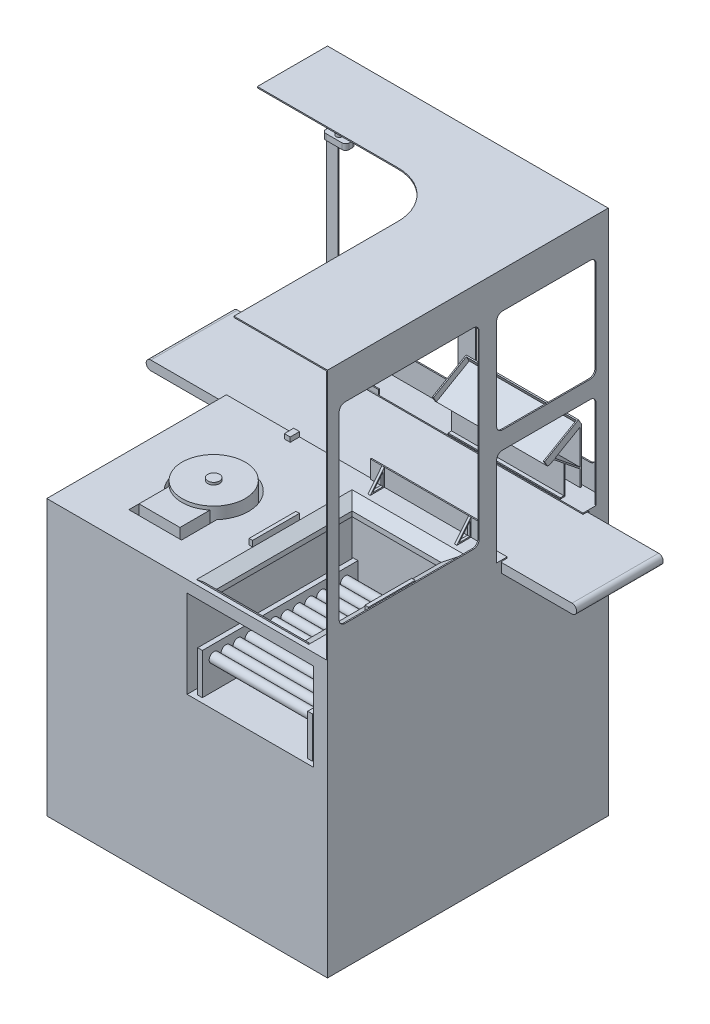
from build123d import *
from build123d.topology import SkipClean

# Parameters (mm, degrees)
SKETCH1_W              = 1200
SKETCH1_H              = 1200
SKETCH1_W_2            = 1190
SKETCH1_H_2            = 1190
BOSS_EXTRUDE1_DEPTH    = 1125
SKETCH2_W              = 540
SKETCH2_H              = 375
CUT_EXTRUDE1_DEPTH     = 50
BOSS_EXTRUDE2_START    = 80
BOSS_EXTRUDE2_DEPTH    = 370
SKETCH4_W              = 1200
SKETCH4_H              = 743
SKETCH4_H_2            = 83
BOSS_EXTRUDE3_DEPTH    = 50
SKETCH5_W              = 380
SKETCH5_H              = 600
CUT_EXTRUDE2_DEPTH     = 50
BOSS_EXTRUDE4_DEPTH    = 375
SKETCH7_W              = 550
SKETCH7_H              = 705
BOSS_EXTRUDE5_DEPTH    = 5
CHAMFER1_SIZE          = 50
CHAMFER1_SIZE2         = 28.867513459
CHAMFER2_SIZE          = 15
CHAMFER2_SIZE2         = 8.660254038
SKETCH8_W              = 1200
SKETCH8_H              = 5
BOSS_EXTRUDE6_DEPTH    = 25
SKETCH9_W              = 1200
SKETCH9_H              = 5
BOSS_EXTRUDE7_DEPTH    = 25
SKETCH10_W             = 20
SKETCH10_H             = 665
BOSS_EXTRUDE8_DEPTH    = 175
SKETCH11_R             = 20.831624677
BOSS_EXTRUDE9_DEPTH    = 450
SKETCH12_W             = 1200
SKETCH12_H             = 5
BOSS_EXTRUDE10_DEPTH   = 1070
CUT_EXTRUDE3_DEPTH     = 50
SKETCH14_W             = 5
SKETCH14_H             = 1195
BOSS_EXTRUDE11_DEPTH   = 1070
CUT_EXTRUDE4_DEPTH     = 50
BOSS_EXTRUDE14_DEPTH   = 5
SKETCH26_W             = 50
SKETCH26_H             = 5
BOSS_EXTRUDE15_DEPTH   = 20
SKETCH26_W_2           = 25
SKETCH26_H_2           = 40
BOSS_EXTRUDE15_2_DEPTH = 20
SKETCH28_R             = 12.5
BOSS_EXTRUDE16_DEPTH   = 50
BOSS_EXTRUDE17_DEPTH   = 25
SKETCH30_R             = 12.5
BOSS_EXTRUDE18_DEPTH   = 50
BOSS_EXTRUDE19_DEPTH   = 25
SKETCH33_W             = 15
SKETCH33_H             = 200
BOSS_EXTRUDE20_DEPTH   = 25
BOSS_EXTRUDE20_2_DEPTH = 25
CUT_EXTRUDE6_DEPTH     = 50
BOSS_EXTRUDE21_DEPTH   = 50
BOSS_EXTRUDE22_DEPTH   = 5
SKETCH37_R             = 135
BOSS_EXTRUDE23_DEPTH   = 140
BOSS_EXTRUDE24_DEPTH   = 125
SKETCH39_R             = 25
BOSS_EXTRUDE25_DEPTH   = 10
SKETCH40_W             = 480
SKETCH40_H             = 5
BOSS_EXTRUDE26_DEPTH   = 75
BOSS_EXTRUDE27_START   = -50
BOSS_EXTRUDE27_DEPTH   = 10
BOSS_EXTRUDE28_START   = -50
BOSS_EXTRUDE28_DEPTH   = 10
SKETCH44_W             = 480
SKETCH44_H             = 5
BOSS_EXTRUDE30_DEPTH   = 300
SKETCH45_W             = 480
SKETCH45_H             = 150
BOSS_EXTRUDE31_DEPTH   = 225
CUT_EXTRUDE7_DEPTH     = 550
BOSS_EXTRUDE32_REACH   = 1610.423
SKETCH47_W             = 480
SKETCH47_H             = 139.903810568
CUT_EXTRUDE8_DEPTH     = 550
BOSS_EXTRUDE33_DEPTH   = 25
SKETCH50_W             = 480
SKETCH50_H             = 5
BOSS_EXTRUDE34_DEPTH   = 15


with BuildPart() as part:
    # Sketch1 → Boss-Extrude1 (new body)
    with BuildSketch(Plane(origin=(0, 0, 0), x_dir=(1, 0, 0), z_dir=(0, 1, 0))):
        Rectangle(SKETCH1_W, SKETCH1_H)
        Rectangle(SKETCH1_W_2, SKETCH1_H_2, mode=Mode.SUBTRACT)
    extrude(amount=BOSS_EXTRUDE1_DEPTH)

    # Sketch2 → Cut-Extrude1 (cut)
    with BuildSketch(Plane.XY.offset(600)):
        with Locations((270, 937.5)):
            Rectangle(SKETCH2_W, SKETCH2_H)
    extrude(amount=-CUT_EXTRUDE1_DEPTH, mode=Mode.SUBTRACT)

    # Sketch4 → Boss-Extrude3 (add)
    with BuildSketch(Plane(origin=(0, 1125, 0), x_dir=(1, 0, 0), z_dir=(0, 1, 0))):
        with Locations((0, -228.5)):
            Rectangle(SKETCH4_W, SKETCH4_H)
        with Locations((0, 558.5)):
            Rectangle(SKETCH4_W, SKETCH4_H_2)
    extrude(amount=BOSS_EXTRUDE3_DEPTH)

    # Sketch5 → Cut-Extrude2 (cut)
    with BuildSketch(Plane(origin=(0, 1175, 0), x_dir=(1, 0, 0), z_dir=(0, 1, 0))):
        with Locations((260, -265)):
            Rectangle(SKETCH5_W, SKETCH5_H)
    extrude(amount=-CUT_EXTRUDE2_DEPTH, mode=Mode.SUBTRACT)

    # Sketch6 → Boss-Extrude4 (add)
    with BuildSketch(Plane.XZ.offset(-1125)):
        Polygon((0, 595), (0, -105), (540, -105), (540, 595), (545, 595), (545, -110), (-5, -110), (-5, 595), align=None)
    extrude(amount=BOSS_EXTRUDE4_DEPTH)

    # Sketch7 → Boss-Extrude5 (add)
    with BuildSketch(Plane.XZ.offset(-750)):
        with Locations((270, 242.5)):
            Rectangle(SKETCH7_W, SKETCH7_H)
    extrude(amount=BOSS_EXTRUDE5_DEPTH)

    # Chamfer1
    chamfer1_edges = [part.edges().sort_by_distance(p)[0] for p in [
        (70, 1175, 265),
        (450, 1175, 265),
        (260, 1175, -35),
    ]]
    chamfer1_side = [part.faces().sort_by_distance(p)[0] for p in [
        (-89.330922242, 1175, 215.959312839),
    ]]
    chamfer(chamfer1_edges, length=CHAMFER1_SIZE, length2=CHAMFER1_SIZE2, reference=chamfer1_side[0])

    # Chamfer2
    chamfer2_edges = [part.edges().sort_by_distance(p)[0] for p in [
        (260, 1175, 565),
    ]]
    chamfer2_side = [part.faces().sort_by_distance(p)[0] for p in [
        (-139.958592133, 1175, 222.30952381),
    ]]
    chamfer(chamfer2_edges, length=CHAMFER2_SIZE, length2=CHAMFER2_SIZE2, reference=chamfer2_side[0])

    # Sketch8 → Boss-Extrude6 (add)
    with BuildSketch(Plane.XY.offset(-517)):
        with Locations((0, 1172.5)):
            Rectangle(SKETCH8_W, SKETCH8_H)
    extrude(amount=BOSS_EXTRUDE6_DEPTH)

    # Sketch9 → Boss-Extrude7 (add)
    with BuildSketch(Plane(origin=(0, 0, -143), x_dir=(-1, 0, 0), z_dir=(0, 0, -1))):
        with Locations((0, 1172.5)):
            Rectangle(SKETCH9_W, SKETCH9_H)
    extrude(amount=BOSS_EXTRUDE7_DEPTH)

    # Sketch10 → Boss-Extrude8 (add)
    with BuildSketch(Plane(origin=(0, 750, 0), x_dir=(1, 0, 0), z_dir=(0, 1, 0))):
        with Locations((35, -247.5)):
            Rectangle(SKETCH10_W, SKETCH10_H)
        with Locations((505, -247.5)):
            Rectangle(SKETCH10_W, SKETCH10_H)
    extrude(amount=BOSS_EXTRUDE8_DEPTH)

    # Sketch11 → Boss-Extrude9 (add)
    with BuildSketch(Plane(origin=(45, 0, 0), x_dir=(0, 0, -1), z_dir=(1, 0, 0))):
        with Locations(Location((-530, 875, 0), (0, 0, 270))):
            Circle(SKETCH11_R)
        with Locations(Location((-479, 875, 0), (0, 0, 270))):
            Circle(SKETCH11_R)
        with Locations(Location((-428, 875, 0), (0, 0, 270))):
            Circle(SKETCH11_R)
        with Locations(Location((-377, 875, 0), (0, 0, 270))):
            Circle(SKETCH11_R)
        with Locations(Location((-326, 875, 0), (0, 0, 270))):
            Circle(SKETCH11_R)
        with Locations(Location((-275, 875, 0), (0, 0, 270))):
            Circle(SKETCH11_R)
        with Locations(Location((-224, 875, 0), (0, 0, 270))):
            Circle(SKETCH11_R)
        with Locations(Location((-173, 875, 0), (0, 0, 270))):
            Circle(SKETCH11_R)
        with Locations(Location((-122, 875, 0), (0, 0, 270))):
            Circle(SKETCH11_R)
        with Locations(Location((-71, 875, 0), (0, 0, 270))):
            Circle(SKETCH11_R)
        with Locations(Location((-20, 875, 0), (0, 0, 270))):
            Circle(SKETCH11_R)
        with Locations(Location((31, 875, 0), (0, 0, 270))):
            Circle(SKETCH11_R)
    extrude(amount=BOSS_EXTRUDE9_DEPTH)

    # Sketch12 → Boss-Extrude10 (add)
    with BuildSketch(Plane(origin=(0, 1175, 0), x_dir=(1, 0, 0), z_dir=(0, 1, 0))):
        with Locations((0, 597.5)):
            Rectangle(SKETCH12_W, SKETCH12_H)
    extrude(amount=BOSS_EXTRUDE10_DEPTH)

    # Sketch13 → Cut-Extrude3 (cut)
    with BuildSketch(Plane.XY.offset(-595)):
        with BuildLine():
            Line((-525, 2095), (-62.5, 2095))
            ThreePointArc((-62.5, 2095), (-44.82233047, 2087.67766953), (-37.5, 2070))
            Line((-37.5, 2070), (-37.5, 1300))
            ThreePointArc((-37.5, 1300), (-44.82233047, 1282.32233047), (-62.5, 1275))
            Line((-62.5, 1275), (-525, 1275))
            ThreePointArc((-525, 1275), (-542.67766953, 1282.32233047), (-550, 1300))
            Line((-550, 1300), (-550, 2070))
            ThreePointArc((-550, 2070), (-542.67766953, 2087.67766953), (-525, 2095))
        make_face()
        with BuildLine():
            Line((62.5, 2095), (525, 2095))
            ThreePointArc((525, 2095), (542.67766953, 2087.67766953), (550, 2070))
            Line((550, 2070), (550, 1300))
            ThreePointArc((550, 1300), (542.67766953, 1282.32233047), (525, 1275))
            Line((525, 1275), (62.5, 1275))
            ThreePointArc((62.5, 1275), (44.82233047, 1282.32233047), (37.5, 1300))
            Line((37.5, 1300), (37.5, 2070))
            ThreePointArc((37.5, 2070), (44.82233047, 2087.67766953), (62.5, 2095))
        make_face()
    extrude(amount=-CUT_EXTRUDE3_DEPTH, mode=Mode.SUBTRACT)

    # Sketch14 → Boss-Extrude11 (add)
    with BuildSketch(Plane(origin=(0, 1175, 0), x_dir=(1, 0, 0), z_dir=(0, 1, 0))):
        with Locations((597.5, -2.5)):
            Rectangle(SKETCH14_W, SKETCH14_H)
    extrude(amount=BOSS_EXTRUDE11_DEPTH)

    # Sketch15 → Cut-Extrude4 (cut)
    with BuildSketch(Plane.ZY.offset(-595)):
        with BuildLine():
            Line((-548, 1175), (-123, 1175))
            Line((-123, 1175), (-123, 1555))
            ThreePointArc((-123, 1555), (-130.32233047, 1572.67766953), (-148, 1580))
            Line((-148, 1580), (-523, 1580))
            ThreePointArc((-523, 1580), (-540.67766953, 1572.67766953), (-548, 1555))
            Line((-548, 1555), (-548, 1175))
        make_face()
        with BuildLine():
            Line((-523, 1655), (-148, 1655))
            ThreePointArc((-148, 1655), (-130.32233047, 1662.32233047), (-123, 1680))
            Line((-123, 1680), (-123, 2070))
            ThreePointArc((-123, 2070), (-130.32233047, 2087.67766953), (-148, 2095))
            Line((-148, 2095), (-523, 2095))
            ThreePointArc((-523, 2095), (-540.67766953, 2087.67766953), (-548, 2070))
            Line((-548, 2070), (-548, 1680))
            ThreePointArc((-548, 1680), (-540.67766953, 1662.32233047), (-523, 1655))
        make_face()
        with BuildLine():
            Line((-23, 2095), (525, 2095))
            ThreePointArc((525, 2095), (542.67766953, 2087.67766953), (550, 2070))
            Line((550, 2070), (550, 1300))
            ThreePointArc((550, 1300), (542.67766953, 1282.32233047), (525, 1275))
            Line((525, 1275), (-23, 1275))
            ThreePointArc((-23, 1275), (-40.67766953, 1282.32233047), (-48, 1300))
            Line((-48, 1300), (-48, 2070))
            ThreePointArc((-48, 2070), (-40.67766953, 2087.67766953), (-23, 2095))
        make_face()
    extrude(amount=-CUT_EXTRUDE4_DEPTH, mode=Mode.SUBTRACT)

    # Sketch25 → Boss-Extrude14 (add)
    with BuildSketch(Plane(origin=(0, 2245, 0), x_dir=(1, 0, 0), z_dir=(0, 1, 0))):
        with BuildLine():
            Line((-600, 600), (-600, 300))
            Line((-600, 300), (0, 300))
            ThreePointArc((0, 300), (141.421356237, 241.421356237), (200, 100))
            Line((200, 100), (200, -600))
            Line((200, -600), (600, -600))
            Line((600, -600), (600, 600))
            Line((600, 600), (-600, 600))
        make_face()
    extrude(amount=BOSS_EXTRUDE14_DEPTH)



with BuildPart() as body_2:
    # Sketch3 → Boss-Extrude2 (new body)
    with BuildSketch(Plane.XY.offset(-595).offset(BOSS_EXTRUDE2_START)):
        with BuildLine():
            Line((-900, 1125), (900, 1125))
            ThreePointArc((900, 1125), (920, 1145), (900, 1165))
            Line((900, 1165), (-900, 1165))
            ThreePointArc((-900, 1165), (-920, 1145), (-900, 1125))
        make_face()
    extrude(amount=BOSS_EXTRUDE2_DEPTH)


with BuildPart() as body_3:
    # Sketch26 → Boss-Extrude15 (new body)
    with BuildSketch(Plane(origin=(0, 1175, 0), x_dir=(1, 0, 0), z_dir=(0, 1, 0))):
        with Locations((-300, 494.5)):
            Rectangle(SKETCH26_W, SKETCH26_H)
    extrude(amount=BOSS_EXTRUDE15_DEPTH)


with BuildPart() as body_4:
    # Sketch26 → Boss-Extrude15 2 (new body)
    with BuildSketch(Plane(origin=(0, 1175, 0), x_dir=(1, 0, 0), z_dir=(0, 1, 0))):
        with Locations((-300, 148)):
            Rectangle(SKETCH26_W_2, SKETCH26_H_2)
    extrude(amount=BOSS_EXTRUDE15_2_DEPTH)


with BuildPart() as body_5:
    # Sketch28 → Boss-Extrude16 (new body)
    with BuildSketch(Plane.XZ.offset(-2245)):
        with Locations(Location((-300, -350, 0), (0, 0, 270))):
            Circle(SKETCH28_R)
    extrude(amount=BOSS_EXTRUDE16_DEPTH)


with BuildPart() as part_1:
    add(part.part)

    add(body_5.part)  # Boss-Extrude17 merges body 5
    # Sketch29 → Boss-Extrude17 (add)
    with BuildSketch(Plane.XZ.offset(-2195)):
        with BuildLine():
            Line((-335, -327.5), (-265, -327.5))
            ThreePointArc((-265, -327.5), (-254.393398282, -331.893398282), (-250, -342.5))
            Line((-250, -342.5), (-250, -357.5))
            ThreePointArc((-250, -357.5), (-254.393398282, -368.106601718), (-265, -372.5))
            Line((-265, -372.5), (-335, -372.5))
            ThreePointArc((-335, -372.5), (-345.606601718, -368.106601718), (-350, -357.5))
            Line((-350, -357.5), (-350, -342.5))
            ThreePointArc((-350, -342.5), (-345.606601718, -331.893398282), (-335, -327.5))
        make_face()
    extrude(amount=BOSS_EXTRUDE17_DEPTH)



with BuildPart() as body_5_2:
    # Sketch30 → Boss-Extrude18 (new body)
    with BuildSketch(Plane.XZ.offset(-2245)):
        with Locations(Location((273, 250, 0), (0, 0, 270))):
            Circle(SKETCH30_R)
    extrude(amount=BOSS_EXTRUDE18_DEPTH)


with BuildPart() as part_2:
    add(part_1.part)

    add(body_5_2.part)  # Boss-Extrude19 merges body 5 2
    # Sketch32 → Boss-Extrude19 (add)
    with BuildSketch(Plane.XZ.offset(-2195)):
        with BuildLine():
            Line((265.5, 300), (280.5, 300))
            ThreePointArc((280.5, 300), (291.106601718, 295.606601718), (295.5, 285))
            Line((295.5, 285), (295.5, 215))
            ThreePointArc((295.5, 215), (291.106601718, 204.393398282), (280.5, 200))
            Line((280.5, 200), (265.5, 200))
            ThreePointArc((265.5, 200), (254.893398282, 204.393398282), (250.5, 215))
            Line((250.5, 215), (250.5, 285))
            ThreePointArc((250.5, 285), (254.893398282, 295.606601718), (265.5, 300))
        make_face()
    extrude(amount=BOSS_EXTRUDE19_DEPTH)

    # Sketch34 → Cut-Extrude6 (cut)
    with BuildSketch(Plane(origin=(0, 1175, 0), x_dir=(1, 0, 0), z_dir=(0, 1, 0))):
        with BuildLine():
            Line((-383.132738686, -315.215674165), (-383.132738686, -216))
            Line((-383.132738686, -216), (-158.132738686, -216))
            Line((-158.132738686, -216), (-158.132738686, -315.215674165))
            ThreePointArc((-158.132738686, -315.215674165), (-130.320586682, -269.033008589), (-120.632738686, -216))
            ThreePointArc((-120.632738686, -216), (-323.665747275, -75.687847996), (-383.132738686, -315.215674165))
        make_face()
        with BuildLine():
            Line((-158.132738686, -216), (-383.132738686, -216))
            Line((-383.132738686, -216), (-383.132738686, -315.215674165))
            ThreePointArc((-383.132738686, -315.215674165), (-270.632738686, -366), (-158.132738686, -315.215674165))
            Line((-158.132738686, -315.215674165), (-158.132738686, -216))
        make_face()
        with BuildLine():
            ThreePointArc((-158.132738686, -315.215674165), (-270.632738686, -366), (-383.132738686, -315.215674165))
            Line((-383.132738686, -315.215674165), (-383.132738686, -466))
            Line((-383.132738686, -466), (-158.132738686, -466))
            Line((-158.132738686, -466), (-158.132738686, -315.215674165))
        make_face()
    extrude(amount=-CUT_EXTRUDE6_DEPTH, mode=Mode.SUBTRACT)

    # Sketch35 → Boss-Extrude21 (add)
    with BuildSketch(Plane.XZ.offset(-1125)):
        with BuildLine():
            Line((-153.132738686, 471), (-153.132738686, 317.087833096))
            ThreePointArc((-153.132738686, 317.087833096), (-270.632738686, 61), (-388.132738686, 317.087833096))
            Line((-388.132738686, 317.087833096), (-388.132738686, 471))
            Line((-388.132738686, 471), (-153.132738686, 471))
        make_face()
        with BuildLine():
            Line((-383.132738686, 466), (-158.132738686, 466))
            Line((-158.132738686, 466), (-158.132738686, 315.215674165))
            ThreePointArc((-158.132738686, 315.215674165), (-270.632738686, 66), (-383.132738686, 315.215674165))
            Line((-383.132738686, 315.215674165), (-383.132738686, 466))
        make_face(mode=Mode.SUBTRACT)
    extrude(amount=BOSS_EXTRUDE21_DEPTH)

    # Sketch36 → Boss-Extrude22 (add)
    with SkipClean():  # the faces are left unmerged after this step: merging them gives an invalid solid
        with BuildSketch(Plane.XZ.offset(-1075)):
            with BuildLine():
                Line((-388.132738686, 471), (-388.132738686, 317.087833096))
                ThreePointArc((-388.132738686, 317.087833096), (-270.632738686, 61), (-153.132738686, 317.087833096))
                Line((-153.132738686, 317.087833096), (-153.132738686, 471))
                Line((-153.132738686, 471), (-388.132738686, 471))
            make_face()
        extrude(amount=BOSS_EXTRUDE22_DEPTH)

    # Sketch37 → Boss-Extrude23 (add)
    with SkipClean():  # the faces are left unmerged after this step: merging them gives an invalid solid
        with BuildSketch(Plane(origin=(0, 1075, 0), x_dir=(1, 0, 0), z_dir=(0, 1, 0))):
            with Locations(Location((-270.632738686, -216, 0), (0, 0, 270))):
                Circle(SKETCH37_R)
        extrude(amount=BOSS_EXTRUDE23_DEPTH)

    # Sketch38 → Boss-Extrude24 (add)
    with SkipClean():  # the faces are left unmerged after this step: merging them gives an invalid solid
        with BuildSketch(Plane(origin=(0, 1075, 0), x_dir=(1, 0, 0), z_dir=(0, 1, 0))):
            with BuildLine():
                Line((-358.132738686, -447.577772241), (-183.132738686, -447.577772241))
                Line((-183.132738686, -447.577772241), (-183.132738686, -318.804425975))
                ThreePointArc((-183.132738686, -318.804425975), (-270.632738686, -351), (-358.132738686, -318.804425975))
                Line((-358.132738686, -318.804425975), (-358.132738686, -447.577772241))
            make_face()
        extrude(amount=BOSS_EXTRUDE24_DEPTH)

    # Sketch39 → Boss-Extrude25 (add)
    with SkipClean():  # the faces are left unmerged after this step: merging them gives an invalid solid
        with BuildSketch(Plane(origin=(0, 1215, 0), x_dir=(1, 0, 0), z_dir=(0, 1, 0))):
            with Locations(Location((-270.632738686, -216, 0), (0, 0, 270))):
                Circle(SKETCH39_R)
        extrude(amount=BOSS_EXTRUDE25_DEPTH)

    # Sketch40 → Boss-Extrude26 (add)
    with SkipClean():  # the faces are left unmerged after this step: merging them gives an invalid solid
        with BuildSketch(Plane(origin=(0, 1175, 0), x_dir=(1, 0, 0), z_dir=(0, 1, 0))):
            with Locations((260, 165.5)):
                Rectangle(SKETCH40_W, SKETCH40_H)
        extrude(amount=BOSS_EXTRUDE26_DEPTH)

    # Sketch41 → Boss-Extrude27 (add)
    with SkipClean():  # the faces are left unmerged after this step: merging them gives an invalid solid
        with BuildSketch(Plane.ZY.offset(-20).offset(BOSS_EXTRUDE27_START)):
            Polygon((-163, 1175), (-103, 1175), (-163, 1250), align=None)
            Polygon((-113.403124237, 1180), (-158, 1235.746094703), (-158, 1180), align=None, mode=Mode.SUBTRACT)
        extrude(amount=-BOSS_EXTRUDE27_DEPTH)

    # Sketch42 → Boss-Extrude28 (add)
    with SkipClean():  # the faces are left unmerged after this step: merging them gives an invalid solid
        with BuildSketch(Plane(origin=(500, 0, 0), x_dir=(0, 0, -1), z_dir=(1, 0, 0)).offset(BOSS_EXTRUDE28_START)):
            Polygon((163, 1175), (103, 1175), (163, 1250), align=None)
            Polygon((113.403124237, 1180), (158, 1235.746094703), (158, 1180), align=None, mode=Mode.SUBTRACT)
        extrude(amount=-BOSS_EXTRUDE28_DEPTH)

    # Sketch44 → Boss-Extrude30 (add)
    with SkipClean():  # the faces are left unmerged after this step: merging them gives an invalid solid
        with BuildSketch(Plane(origin=(0, 1175, 0), x_dir=(1, 0, 0), z_dir=(0, 1, 0))):
            with Locations((260, 582.5)):
                Rectangle(SKETCH44_W, SKETCH44_H)
        extrude(amount=BOSS_EXTRUDE30_DEPTH)

    # Sketch45 → Boss-Extrude31 (add)
    with SkipClean():  # the faces are left unmerged after this step: merging them gives an invalid solid
        with BuildSketch(Plane.XY.offset(-580)):
            with Locations((260, 1400)):
                Rectangle(SKETCH45_W, SKETCH45_H)
        extrude(amount=BOSS_EXTRUDE31_DEPTH)

    # Sketch46 → Cut-Extrude7 (cut)
    with SkipClean():  # the faces are left unmerged after this step: merging them gives an invalid solid
        with BuildSketch(Plane.ZY.offset(-20)):
            Polygon((-580, 1325), (-580, 1400), (-450.096189432, 1325), align=None)
            Polygon((-581.300161966, 1406.524151553), (-440.096189432, 1325), (-355, 1325), (-355, 1475), (-580, 1475), (-585, 1475), (-585, 1408.660254038), align=None)
        extrude(amount=-CUT_EXTRUDE7_DEPTH, mode=Mode.SUBTRACT)

    # Boss-Extrude32: up to this plane
    with SkipClean():  # the faces are left unmerged after this step: merging them gives an invalid solid
        boss_extrude32_end = Plane(origin=(570, 1400, -580), z_dir=(0, 0.8660254037844364, 0.5000000000000041))
        # Sketch47 → Boss-Extrude32 (add, up to the surface)
        with BuildSketch(Plane(origin=(0, 1175, 0), x_dir=(1, 0, 0), z_dir=(0, 1, 0)), mode=Mode.PRIVATE) as boss_extrude32_sk1:
            with Locations((260, 510.048094716)):
                Rectangle(SKETCH47_W, SKETCH47_H)
        boss_extrude32_tool1 = split(extrude(boss_extrude32_sk1.sketch, amount=BOSS_EXTRUDE32_REACH, mode=Mode.PRIVATE), bisect_by=boss_extrude32_end, keep=Keep.BOTH, mode=Mode.PRIVATE)
        add(boss_extrude32_tool1.solids().sort_by_distance((260, 1175, -510.048095))[0])

    # Sketch48 → Cut-Extrude8 (cut)
    with SkipClean():  # the faces are left unmerged after this step: merging them gives an invalid solid
        with BuildSketch(Plane.ZY.offset(-20)):
            Polygon((-580, 1250.565620106), (-472.190285996, 1337.756032598), (-580, 1400), align=None)
            Polygon((-440.096189432, 1319.226497308), (-450.096189432, 1325), (-467.550971541, 1335.077523149), (-510.340080757, 1300.4721064), (-510.340080757, 1175), (-492, 1175), (-440.096189432, 1175), align=None)
            Polygon((-515.340080757, 1175), (-515.340080757, 1296.428388573), (-580, 1244.135094944), (-580, 1175), align=None)
        extrude(amount=-CUT_EXTRUDE8_DEPTH, mode=Mode.SUBTRACT)

    # Sketch49 → Boss-Extrude33 (add)
    with SkipClean():  # the faces are left unmerged after this step: merging them gives an invalid solid
        with BuildSketch(Plane(origin=(0, 803.182759921, 463.717782649), x_dir=(1, 0, 0), z_dir=(0, 0.8660254037844363, 0.5000000000000042))):
            Polygon((20, 1043.634480157), (25, 1043.634480157), (25, 1205.954988233), (495, 1205.954988233), (495, 1043.634480157), (500, 1043.634480157), (500, 1210.954988233), (495, 1210.954988233), (25, 1210.954988233), (20, 1210.954988233), align=None)
        extrude(amount=BOSS_EXTRUDE33_DEPTH)

    # Sketch50 → Boss-Extrude34 (add)
    with SkipClean():  # the faces are left unmerged after this step: merging them gives an invalid solid
        with BuildSketch(Plane.XY.offset(-510.340080757)):
            with Locations((260, 1177.5)):
                Rectangle(SKETCH50_W, SKETCH50_H)
        extrude(amount=BOSS_EXTRUDE34_DEPTH)


with BuildPart() as body_5_3:
    # Sketch33 → Boss-Extrude20 (new body)
    with BuildSketch(Plane(origin=(0, 1175, 0), x_dir=(1, 0, 0), z_dir=(0, 1, 0))):
        with Locations((507.5, -240)):
            Rectangle(SKETCH33_W, SKETCH33_H)
    extrude(amount=BOSS_EXTRUDE20_DEPTH)


with BuildPart() as body_6:
    # Sketch33 → Boss-Extrude20 2 (new body)
    with BuildSketch(Plane(origin=(0, 1175, 0), x_dir=(1, 0, 0), z_dir=(0, 1, 0))):
        with Locations((12.5, -240)):
            Rectangle(SKETCH33_W, SKETCH33_H)
    extrude(amount=BOSS_EXTRUDE20_2_DEPTH)


solid = Compound([body_2.part, body_3.part, body_4.part, part_2.part, body_5_3.part, body_6.part])
